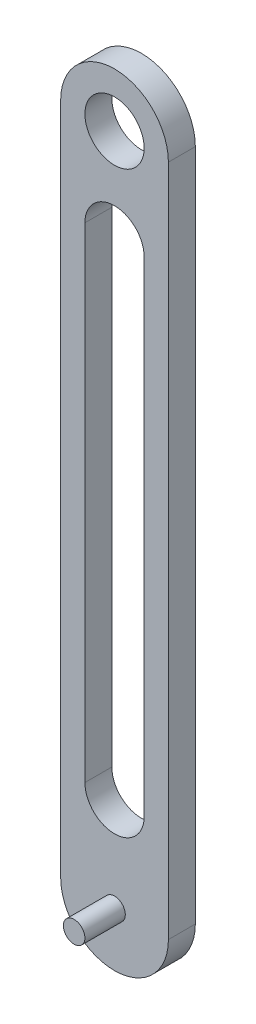
from build123d import *

# Parameters (mm, degrees)
SKETCH5_R           = 4
SKETCH5_R_2         = 11
BOSS_EXTRUDE4_DEPTH = 10
SKETCH5_3_R         = 4
BOSS_EXTRUDE5_DEPTH = 25


with BuildPart() as part:
    # Sketch5 → Boss-Extrude4 (new body)
    with BuildSketch(Plane.XY):
        with BuildLine():
            ThreePointArc((20, 125), (0, 145), (-20, 125))
            Line((-20, 125), (-20, -125))
            ThreePointArc((-20, -125), (0, -145), (20, -125))
            Line((20, -125), (20, 125))
        make_face()
        with Locations((0, -125)):
            Circle(SKETCH5_R, mode=Mode.SUBTRACT)
        with BuildLine():
            Line((-11, -90), (-11, 90))
            ThreePointArc((-11, 90), (0, 101), (11, 90))
            Line((11, 90), (11, -90))
            ThreePointArc((11, -90), (0, -101), (-11, -90))
        make_face(mode=Mode.SUBTRACT)
        with Locations((0, 125)):
            Circle(SKETCH5_R_2, mode=Mode.SUBTRACT)
    extrude(amount=BOSS_EXTRUDE4_DEPTH)

    # Sketch5<3> → Boss-Extrude5 (add)
    with BuildSketch(Plane.XY):
        with Locations((0, -125)):
            Circle(SKETCH5_3_R)
    extrude(amount=BOSS_EXTRUDE5_DEPTH)


solid = part.part
